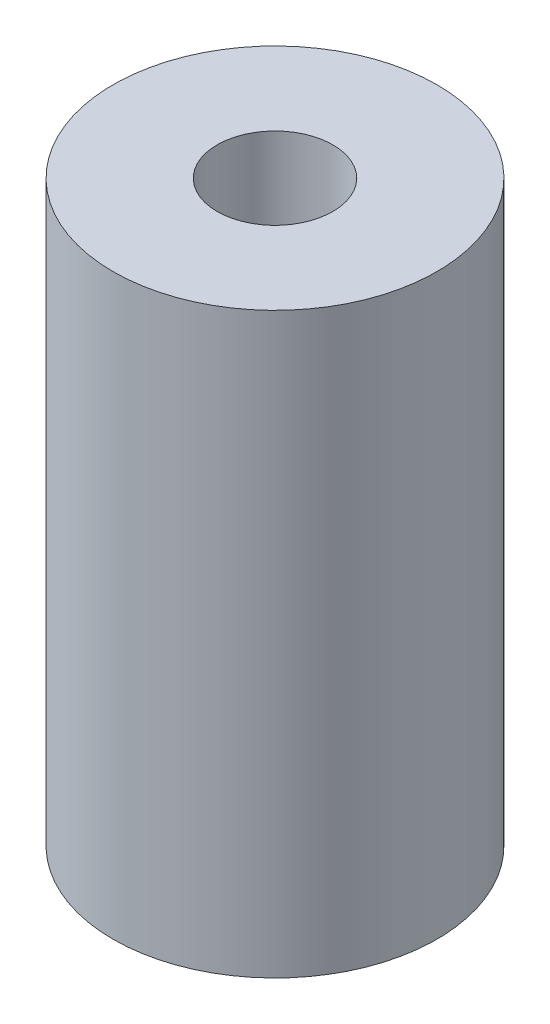
from build123d import *

# Parameters (mm, degrees)
SKETCH_1_R          = 7
EXTRUDE_1_DEPTH     = 25
SKETCH_2_R          = 2.5
CUT_EXTRUDE_1_DEPTH = 12
SKETCH_3_R          = 4
CUT_EXTRUDE_2_DEPTH = 13


with BuildPart() as part:
    # 草图1 → 凸台-拉伸1 (new body)
    with BuildSketch(Plane(origin=(0, 0, 0), x_dir=(1, 0, 0), z_dir=(0, 1, 0))):
        with Locations(Location((0, 0, 0), (0, 0, 270))):
            Circle(SKETCH_1_R)
    extrude(amount=EXTRUDE_1_DEPTH)

    # 草图2 → 切除-拉伸1 (cut)
    with BuildSketch(Plane(origin=(0, 25, 0), x_dir=(1, 0, 0), z_dir=(0, 1, 0))):
        with Locations(Location((0, 0, 0), (0, 0, 270))):
            Circle(SKETCH_2_R)
    extrude(amount=-CUT_EXTRUDE_1_DEPTH, mode=Mode.SUBTRACT)

    # 草图3 → 切除-拉伸2 (cut)
    with BuildSketch(Plane.XZ):
        with Locations(Location((0, 0, 0), (0, 0, 270))):
            Circle(SKETCH_3_R)
    extrude(amount=-CUT_EXTRUDE_2_DEPTH, mode=Mode.SUBTRACT)


solid = part.part
